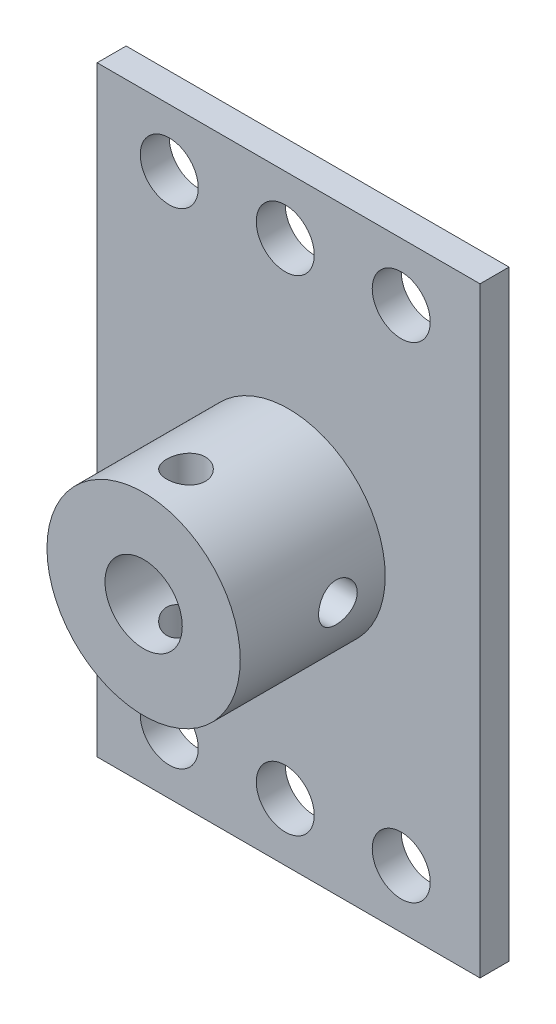
from build123d import *

# Parameters (mm, degrees)
CROQUIS1_W                 = 39.618473901
CROQUIS1_H                 = 62.206373563
SALIENTE_EXTRUIR1_DEPTH    = 3
CROQUIS2_R                 = 10
SALIENTE_EXTRUIR2_DEPTH    = 15
CROQUIS3_R                 = 4
CORTAR_EXTRUIR1_DEPTH      = 63.693025162
CORTAR_EXTRUIR3_DEPTH      = 63.693025162
CORTAR_EXTRUIR3_DEPTH_BACK = 63.693025162
CROQUIS5_R                 = 2
CROQUIS6_R                 = 3
CORTAR_EXTRUIR4_DEPTH      = 10
CORTAR_EXTRUIR5_DEPTH      = 63.69302519
CORTAR_EXTRUIR5_DEPTH_BACK = 63.69302519
CROQUIS7_R                 = 2


with BuildPart() as part:
    # Croquis1 → Saliente-Extruir1 (new body)
    with BuildSketch(Plane.XY):
        with Locations((28.835278497, -4.112243371)):
            Rectangle(CROQUIS1_W, CROQUIS1_H)
    extrude(amount=SALIENTE_EXTRUIR1_DEPTH)

    # Croquis2 → Saliente-Extruir2 (add)
    with BuildSketch(Plane.XY.offset(3)):
        with Locations((28.835278496, -4.112243372)):
            Circle(CROQUIS2_R)
    extrude(amount=SALIENTE_EXTRUIR2_DEPTH)

    # Croquis3 → Cortar-Extruir1 (cut, through all)
    with BuildSketch(Plane.XY.offset(18)):
        with Locations((28.835278496, -4.112243372)):
            Circle(CROQUIS3_R)
    extrude(amount=-CORTAR_EXTRUIR1_DEPTH, mode=Mode.SUBTRACT)

    # Croquis5 → Cortar-Extruir3 (cut, two sides: drawn at the far end of the back side and taken through both)
    with BuildSketch(Plane(origin=(0, 0, 0), x_dir=(0, 0, -1), z_dir=(1, 0, 0)).offset(-CORTAR_EXTRUIR3_DEPTH_BACK)):
        with Locations(Location((-7.893110832, -4.112243372, 0), (0, 0, 180))):
            Circle(CROQUIS5_R)
    extrude(amount=CORTAR_EXTRUIR3_DEPTH + CORTAR_EXTRUIR3_DEPTH_BACK, mode=Mode.SUBTRACT)

    # Croquis6 → Cortar-Extruir4 (cut)
    with BuildSketch(Plane(origin=(0, 0, 0), x_dir=(-1, 0, 0), z_dir=(0, 0, -1))):
        with Locations((-40.490083912, -29.215430153)):
            Circle(CROQUIS6_R)
        with Locations((-28.490083912, -29.215430153)):
            Circle(CROQUIS6_R)
        with Locations((-16.490083912, -29.215430153)):
            Circle(CROQUIS6_R)
        with Locations((-28.490083912, 20.99094341)):
            Circle(CROQUIS6_R)
        with Locations((-40.490083912, 20.99094341)):
            Circle(CROQUIS6_R)
        with Locations((-16.490083912, 20.99094341)):
            Circle(CROQUIS6_R)
    extrude(amount=-CORTAR_EXTRUIR4_DEPTH, mode=Mode.SUBTRACT)

    # Croquis7 → Cortar-Extruir5 (cut, two sides: drawn at the far end of the back side and taken through both)
    with BuildSketch(Plane(origin=(0, 0, 0), x_dir=(1, 0, 0), z_dir=(0, 1, 0)).offset(-CORTAR_EXTRUIR5_DEPTH_BACK)):
        with Locations(Location((28.835278496, -13.615803353, 0), (0, 0, 270))):
            Circle(CROQUIS7_R)
    extrude(amount=CORTAR_EXTRUIR5_DEPTH + CORTAR_EXTRUIR5_DEPTH_BACK, mode=Mode.SUBTRACT)


solid = part.part
